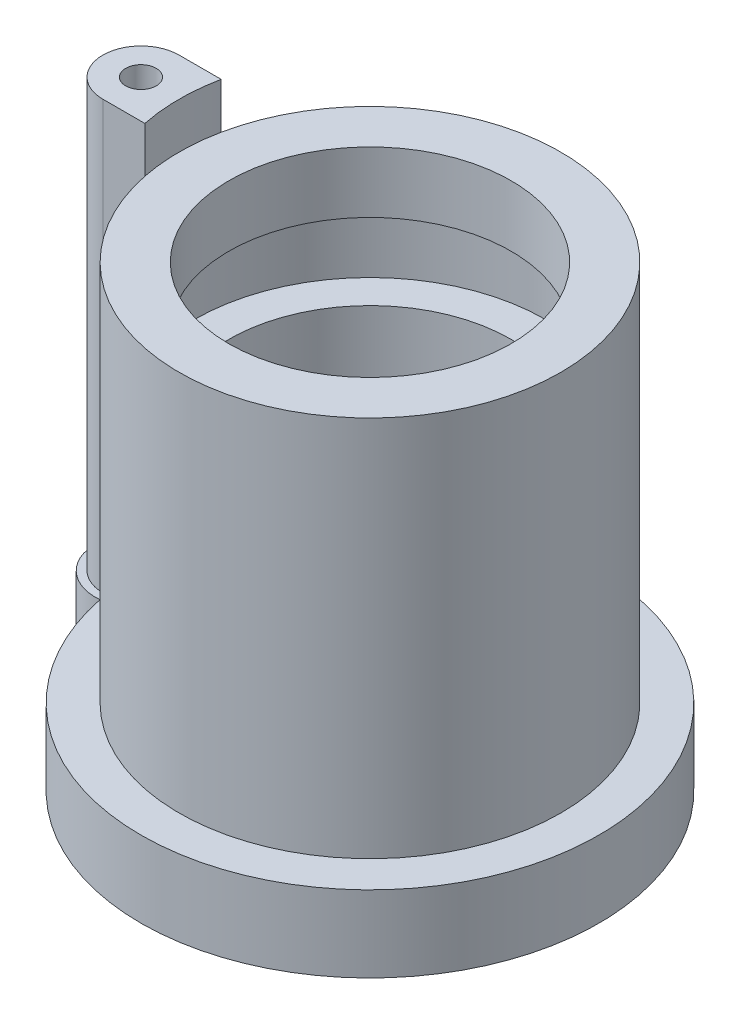
from build123d import *

# Parameters (mm, degrees)
SKETCH1_R           = 12.5
SKETCH1_R_2         = 11.5
SKETCH1_R_3         = 9.25
BOSS_EXTRUDE1_DEPTH = 25
CUT_EXTRUDE1_START  = -5
SKETCH2_R           = 11.5
SKETCH2_R_2         = 9.25
CUT_EXTRUDE1_DEPTH  = 5
BOSS_EXTRUDE2_START = 5
SKETCH3_R           = 9.25
BOSS_EXTRUDE2_DEPTH = 5
SKETCH4_R           = 1
BOSS_EXTRUDE5_DEPTH = 28


with BuildPart() as part:
    # Sketch1 → Boss-Extrude1 (new body)
    # profile 1 of 2: a face of its own
    with BuildSketch(Plane(origin=(0, 0, 0), x_dir=(1, 0, 0), z_dir=(0, 1, 0))):
        with Locations(Location((0, 0, 0), (0, 0, 270))):
            Circle(SKETCH1_R)
        Circle(SKETCH1_R_2, mode=Mode.SUBTRACT)
    # profile 2 of 2: a face of its own
    with BuildSketch(Plane(origin=(0, 0, 0), x_dir=(1, 0, 0), z_dir=(0, 1, 0))):
        Circle(SKETCH1_R_2)
        with Locations(Location((0, 0, 0), (0, 0, 270))):
            Circle(SKETCH1_R_3, mode=Mode.SUBTRACT)
    extrude(amount=BOSS_EXTRUDE1_DEPTH)

    # Sketch2 → Cut-Extrude1 (cut)
    with BuildSketch(Plane(origin=(0, 21, 0), x_dir=(1, 0, 0), z_dir=(0, 1, 0)).offset(CUT_EXTRUDE1_START)):
        with Locations(Location((0, 0, 0), (0, 0, 270))):
            Circle(SKETCH2_R)
        with Locations(Location((0, 0, 0), (0, 0, 270))):
            Circle(SKETCH2_R_2, mode=Mode.SUBTRACT)
    extrude(amount=CUT_EXTRUDE1_DEPTH, mode=Mode.SUBTRACT)

    # Sketch3 → Boss-Extrude2 (add)
    with BuildSketch(Plane.XZ.offset(BOSS_EXTRUDE2_START)):
        with BuildLine():
            ThreePointArc((-14.7, -2.984962311), (15, 0), (-14.7, 2.984962311))
            ThreePointArc((-14.7, 2.984962311), (-18, 0), (-14.7, -2.984962311))
        make_face()
        with Locations(Location((0, 0, 0), (0, 0, 270))):
            Circle(SKETCH3_R, mode=Mode.SUBTRACT)
    extrude(amount=-BOSS_EXTRUDE2_DEPTH)

    # Sketch4 → Boss-Extrude5 (add)
    with BuildSketch(Plane(origin=(0, 0, 0), x_dir=(1, 0, 0), z_dir=(0, 1, 0))):
        with BuildLine():
            Line((-12.247448714, 2.5), (-15, 2.5))
            ThreePointArc((-15, 2.5), (-17.5, 0), (-15, -2.5))
            Line((-15, -2.5), (-12.247448714, -2.5))
            ThreePointArc((-12.247448714, -2.5), (-12.5, 0), (-12.247448714, 2.5))
        make_face()
        with Locations(Location((-15, 0, 0), (0, 0, 270))):
            Circle(SKETCH4_R, mode=Mode.SUBTRACT)
    extrude(amount=BOSS_EXTRUDE5_DEPTH)


solid = part.part
